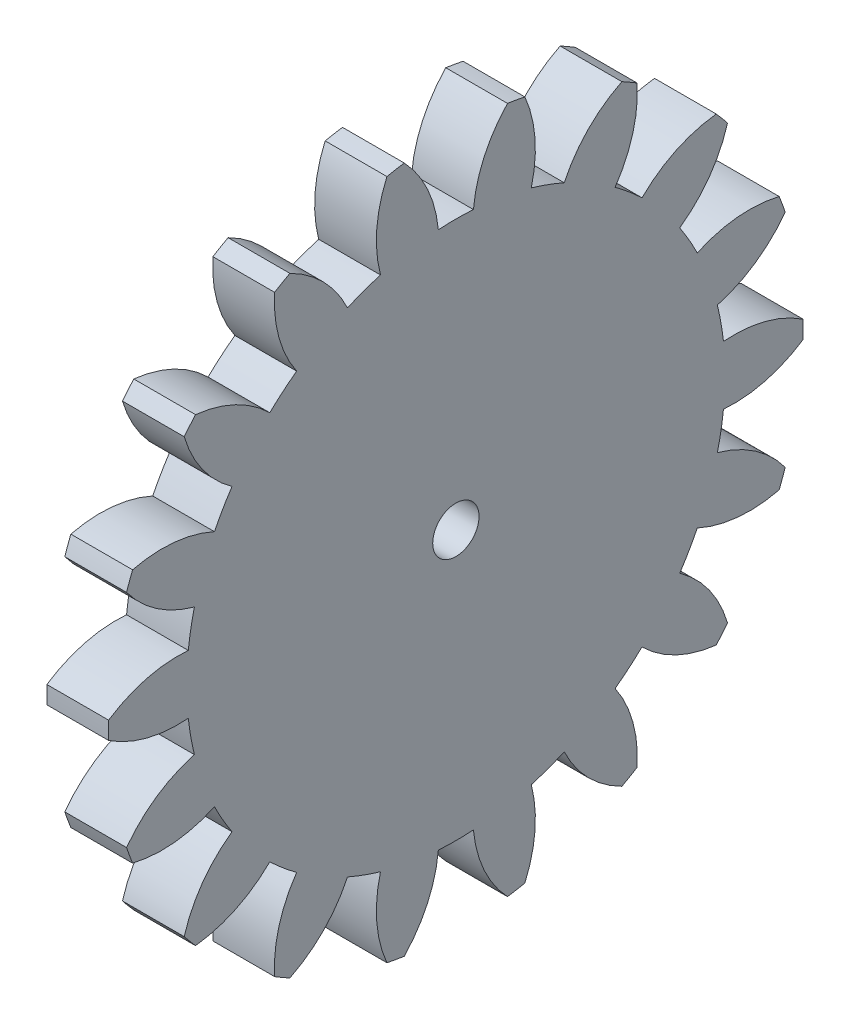
from build123d import *

# Parameters (mm, degrees)
BASPROSKE_W     = 4
BASPROSKE_H     = 22.5
TOOTHCUT_DEPTH  = 33.070235422
TEETHCUTS_COUNT = 18
TEETHCUTS_ANGLE = 340
BORSKE_R        = 1.5
BORE_DEPTH      = 50.0000508


with BuildPart() as part:
    # BasProSke → Base-Revolve (revolve)
    with BuildSketch(Plane(origin=(0, 0, 0), x_dir=(1, 0, 0), z_dir=(0, 1, 0))):
        with Locations((2, 11.25)):
            Rectangle(BASPROSKE_W, BASPROSKE_H)
    revolve(axis=Axis((-10, 0, 0), (1, 0, 0)))

    # TooCutSke → ToothCut (cut, through all)
    with BuildSketch(Plane(origin=(0, 0, 0), x_dir=(0, 0, -1), z_dir=(1, 0, 0))):
        with BuildLine():
            ThreePointArc((1.136237076, 17.399439576), (0, 17.4365), (-1.136237076, 17.399439576))
            ThreePointArc((-1.136237076, 17.399439576), (-1.836299497, 20.025700007), (-3.36570362, 22.272532059))
            ThreePointArc((-3.36570362, 22.272532059), (0, 22.5254), (3.36570362, 22.272532059))
            ThreePointArc((3.36570362, 22.272532059), (1.836299497, 20.025700007), (1.136237076, 17.399439576))
        make_face()
    toothcut = extrude(amount=TOOTHCUT_DEPTH, mode=Mode.SUBTRACT)

    # TeethCuts: ToothCut ×18 about axis
    teethcuts_axis = Axis((-10, 0, 0), (1, 0, 0))
    for i in range(1, TEETHCUTS_COUNT):
        add(toothcut.rotate(teethcuts_axis, i * TEETHCUTS_ANGLE / (TEETHCUTS_COUNT - 1)), mode=Mode.SUBTRACT)

    # BorSke → Bore (cut, symmetric)
    with BuildSketch(Plane(origin=(0, 0, 0), x_dir=(0, 0, -1), z_dir=(1, 0, 0))):
        Circle(BORSKE_R)
    extrude(amount=BORE_DEPTH, both=True, mode=Mode.SUBTRACT)


solid = part.part
